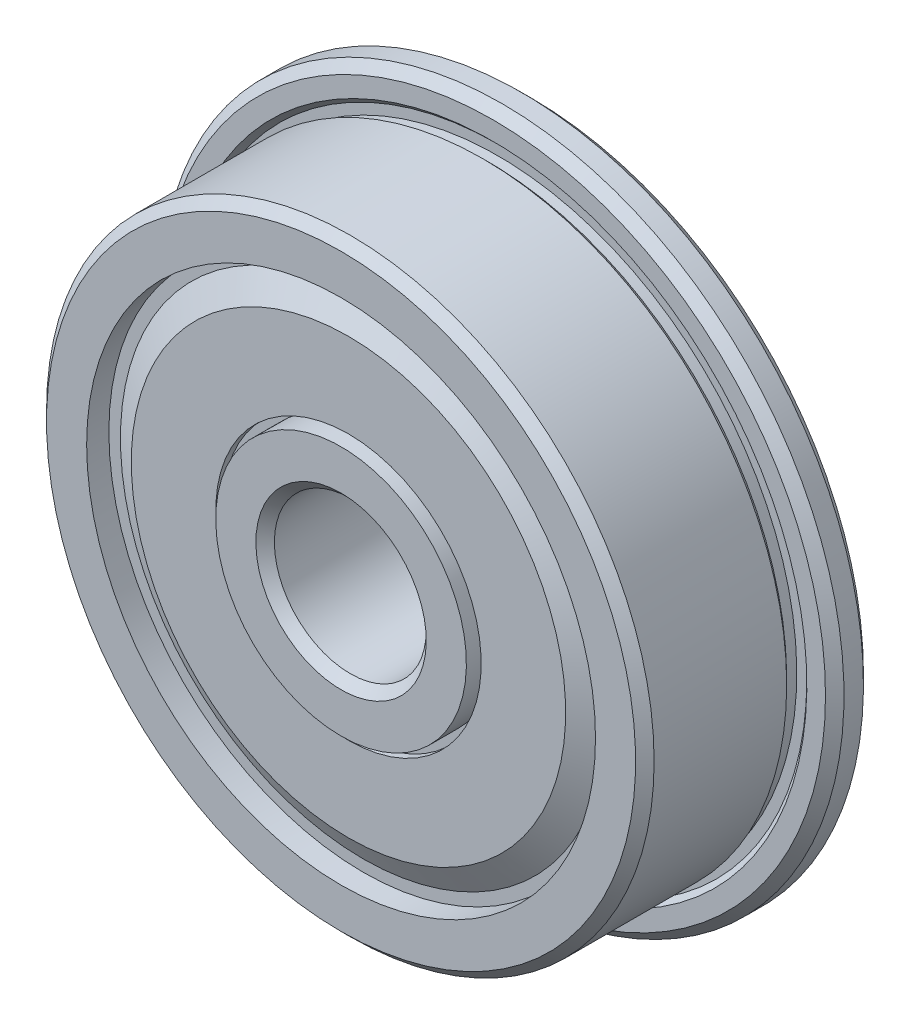
from build123d import *

# Parameters (mm, degrees)
FILLET1_SIZE      = 0.24375
FILLET2_SIZE      = 0.24375
CIRPATTERN3_COUNT = 9
SKETCH8_W         = 0.78
SKETCH8_H         = 0.65


with BuildPart() as part:
    # Sketch2 → Revolve1 (revolve)
    with BuildSketch(Plane(origin=(0, 0, 0), x_dir=(0, 0, -1), z_dir=(1, 0, 0)), mode=Mode.PRIVATE) as revolve1_sk:
        with BuildLine():
            Line((2.5, 9), (1.5, 9))
            Line((1.5, 9), (1.5, 8.265165043))
            Line((1.5, 8.265165043), (1.632582521, 8.132582521))
            Line((1.632582521, 8.132582521), (1.632582521, 7.867417479))
            Line((1.632582521, 7.867417479), (1.367417479, 7.867417479))
            Line((1.367417479, 7.867417479), (1.234834957, 8))
            Line((1.234834957, 8), (-2.5, 8))
            Line((-2.5, 8), (-2.5, 6.05))
            Line((-2.5, 6.05), (-0.561061717, 6.05))
            ThreePointArc((-0.561061717, 6.05), (0, 6.1905), (0.561061717, 6.05))
            Line((0.561061717, 6.05), (2.5, 6.05))
            Line((2.5, 6.05), (2.5, 9))
        make_face()
        with BuildLine():
            Line((2.5, 2), (-2.5, 2))
            Line((-2.5, 2), (-2.5, 3.95))
            Line((-2.5, 3.95), (-0.561061717, 3.95))
            ThreePointArc((-0.561061717, 3.95), (0, 3.8095), (0.561061717, 3.95))
            Line((0.561061717, 3.95), (2.5, 3.95))
            Line((2.5, 3.95), (2.5, 2))
        make_face()
    revolve(revolve1_sk.sketch.rotate(Axis((0, 0, 0), (0, 0, -1)), 180), axis=Axis((0, 0, 0), (0, 0, -1)))

    # Fillet1
    fillet1_edges = [part.edges().sort_by_distance(p)[0] for p in [
        (0, 8, 2.5),
        (0, 9, -2.5),
        (0, 9, -1.5),
    ]]
    chamfer(fillet1_edges, length=FILLET1_SIZE)

    # Fillet2
    fillet2_edges = [part.edges().sort_by_distance(p)[0] for p in [
        (0, 2, -2.5),
        (0, 2, 2.5),
    ]]
    chamfer(fillet2_edges, length=FILLET2_SIZE)

    # Sketch8 → Cut-Revolve1 (revolve, cut)
    with BuildSketch(Plane(origin=(0, 0, 0), x_dir=(0, 0, -1), z_dir=(1, 0, 0)), mode=Mode.PRIVATE) as cut_revolve1_sk:
        with Locations((-2.11, 6.375)):
            Rectangle(SKETCH8_W, SKETCH8_H)
        with Locations((2.11, 6.375)):
            Rectangle(SKETCH8_W, SKETCH8_H)
        with Locations((2.11, 3.625)):
            Rectangle(SKETCH8_W, SKETCH8_H)
        with Locations((-2.11, 3.625)):
            Rectangle(SKETCH8_W, SKETCH8_H)
    revolve(cut_revolve1_sk.sketch.rotate(Axis((0, 0, 0), (0, 0, -1)), 180), axis=Axis((0, 0, 0), (0, 0, -1)), mode=Mode.SUBTRACT)


with BuildPart() as body_2:
    # Sketch7 → Revolve3 (revolve)
    with BuildSketch(Plane.XY):
        with BuildLine():
            Line((0, 6.1905), (0, 3.8095))
            ThreePointArc((0, 3.8095), (-1.1905, 5), (0, 6.1905))
        make_face()
    revolve(axis=Axis((0, 6.1905, 0), (0, -1, 0)))


with BuildPart() as cirpattern3_1:
    # CirPattern3: pattern copy
    add(body_2.part.rotate(Axis((0, 0, 0), (0, 0, 1)), 1 * 360 / CIRPATTERN3_COUNT))


with BuildPart() as cirpattern3_2:
    # CirPattern3: pattern copy
    add(body_2.part.rotate(Axis((0, 0, 0), (0, 0, 1)), 2 * 360 / CIRPATTERN3_COUNT))


with BuildPart() as cirpattern3_3:
    # CirPattern3: pattern copy
    add(body_2.part.rotate(Axis((0, 0, 0), (0, 0, 1)), 3 * 360 / CIRPATTERN3_COUNT))


with BuildPart() as cirpattern3_4:
    # CirPattern3: pattern copy
    add(body_2.part.rotate(Axis((0, 0, 0), (0, 0, 1)), 4 * 360 / CIRPATTERN3_COUNT))


with BuildPart() as cirpattern3_5:
    # CirPattern3: pattern copy
    add(body_2.part.rotate(Axis((0, 0, 0), (0, 0, 1)), 5 * 360 / CIRPATTERN3_COUNT))


with BuildPart() as cirpattern3_6:
    # CirPattern3: pattern copy
    add(body_2.part.rotate(Axis((0, 0, 0), (0, 0, 1)), 6 * 360 / CIRPATTERN3_COUNT))


with BuildPart() as cirpattern3_7:
    # CirPattern3: pattern copy
    add(body_2.part.rotate(Axis((0, 0, 0), (0, 0, 1)), 7 * 360 / CIRPATTERN3_COUNT))


with BuildPart() as cirpattern3_8:
    # CirPattern3: pattern copy
    add(body_2.part.rotate(Axis((0, 0, 0), (0, 0, 1)), 8 * 360 / CIRPATTERN3_COUNT))


with BuildPart() as body_11:
    # Sketch9 → Revolve4 (revolve)
    with BuildSketch(Plane(origin=(0, 0, 0), x_dir=(0, 0, -1), z_dir=(1, 0, 0)), mode=Mode.PRIVATE) as revolve4_sk:
        Polygon((-1.72, 6.7), (-1.72, 6.342857143), (-2.11, 5.667357328), (-2.11, 3.495), (-2.305, 3.495), (-2.305, 5.71960742), (-1.915, 6.395107235), (-1.915, 6.7), align=None)
        Polygon((1.72, 6.7), (1.72, 6.342857143), (2.11, 5.667357328), (2.11, 3.495), (2.305, 3.495), (2.305, 5.71960742), (1.915, 6.395107235), (1.915, 6.7), align=None)
    revolve(revolve4_sk.sketch.rotate(Axis((0, 0, 0), (0, 0, -1)), 180), axis=Axis((0, 0, 0), (0, 0, -1)))


solid = Compound([part.part, body_2.part, cirpattern3_1.part, cirpattern3_2.part, cirpattern3_3.part, cirpattern3_4.part, cirpattern3_5.part, cirpattern3_6.part, cirpattern3_7.part, cirpattern3_8.part, body_11.part])
